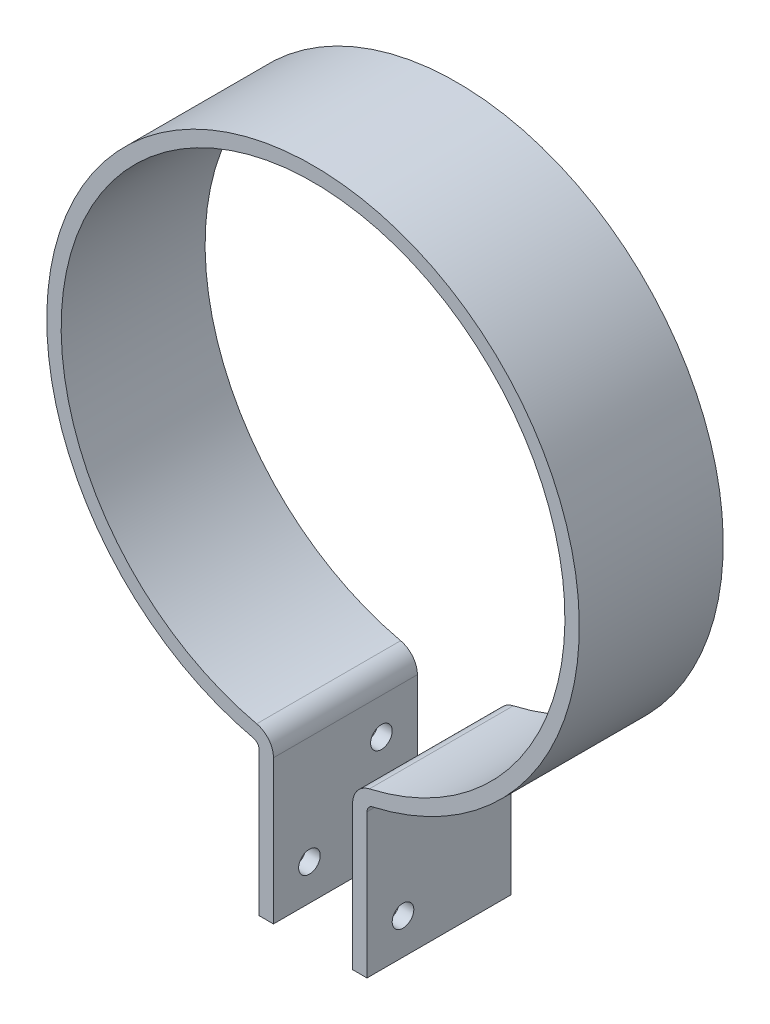
from build123d import *

# Parameters (mm, degrees)
EXTRUSION2_DEPTH = 20
ESQUISSE8_R      = 1.5
EXTRUSION3_DEPTH = 76.056550285
ESQUISSE9_R      = 1.5
EXTRUSION4_DEPTH = 76.056550285


with BuildPart() as part:
    # Esquisse7 → Extrusion2 (new body)
    with BuildSketch(Plane.XY):
        with BuildLine():
            Line((5.5, -57.037143518), (7.5, -57.037143518))
            Line((7.5, -57.037143518), (7.5, -37.037143518))
            ThreePointArc((7.5, -37.037143518), (7.717796634, -36.414120329), (8.276315789, -36.062481847))
            ThreePointArc((8.276315789, -36.062481847), (0, 37), (-8.276315789, -36.062481847))
            ThreePointArc((-8.276315789, -36.062481847), (-7.717796634, -36.414120329), (-7.5, -37.037143518))
            Line((-7.5, -37.037143518), (-7.5, -57.037143518))
            Line((-7.5, -57.037143518), (-5.5, -57.037143518))
            Line((-5.5, -57.037143518), (-5.5, -37.037143518))
            ThreePointArc((-5.5, -37.037143518), (-6.153389903, -35.16807395), (-7.828947368, -34.113158504))
            ThreePointArc((-7.828947368, -34.113158504), (0, 35), (7.828947368, -34.113158504))
            ThreePointArc((7.828947368, -34.113158504), (6.153389903, -35.16807395), (5.5, -37.037143518))
            Line((5.5, -37.037143518), (5.5, -57.037143518))
        make_face()
    extrude(amount=EXTRUSION2_DEPTH)

    # Esquisse8 → Extrusion3 (cut, through all)
    with BuildSketch(Plane.ZY.offset(7.5)):
        with Locations((15, -52.037143518)):
            Circle(ESQUISSE8_R)
    extrude(amount=-EXTRUSION3_DEPTH, mode=Mode.SUBTRACT)

    # Esquisse9 → Extrusion4 (cut, through all)
    with BuildSketch(Plane.ZY.offset(7.5)):
        with Locations((5, -42.037143518)):
            Circle(ESQUISSE9_R)
    extrude(amount=-EXTRUSION4_DEPTH, mode=Mode.SUBTRACT)


solid = part.part
